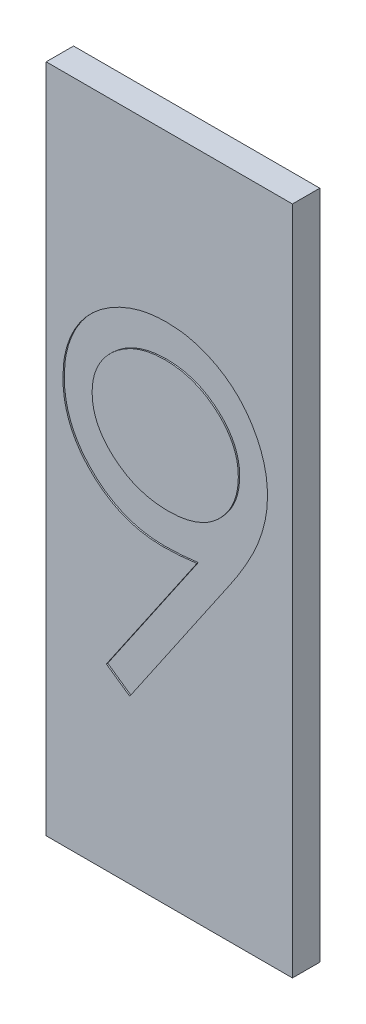
from build123d import *

# Parameters (mm, degrees)
SKETCH_1_W          = 18
SKETCH_1_H          = 49
EXTRUDE_1_DEPTH     = 2
CUT_EXTRUDE_1_DEPTH = 0.1


with BuildPart() as part:
    # ｽｹｯﾁ1 → ﾎﾞｽ - 押し出し1 (new body)
    with BuildSketch(Plane.XY):
        with Locations((9, 24.5)):
            Rectangle(SKETCH_1_W, SKETCH_1_H)
    extrude(amount=EXTRUDE_1_DEPTH)

    # ｽｹｯﾁ2 → ｶｯﾄ - 押し出し1 (cut)
    with BuildSketch(Plane.XY.offset(2)):
        with BuildLine():
            Line((6.105769231, 11.889423077), (4.398061899, 13.077185998))
            Line((4.398061899, 13.077185998), (11.019005409, 22.755784255))
            add(Edge.make_bspline(
                [(11.019005409, 22.755784255), (10.596566654, 22.704124306), (9.764761194, 22.602402987), (8.926989124, 22.583715925), (8.514685998, 22.574519231)],
                knots=[0, 0, 0, 0, 1.015715272, 2, 2, 2, 2], degree=3))
            add(Edge.make_bspline(
                [(8.514685998, 22.574519231), (8.264708851, 22.580921912), (7.774025572, 22.593489814), (7.05263165, 22.693106403), (6.359445961, 22.846527808), (5.696306236, 23.075459517), (5.060719962, 23.359972689), (4.454074662, 23.712785585), (3.877186979, 24.127846247), (3.336252636, 24.602959993), (2.844274555, 25.1246446), (2.405966047, 25.676792814), (2.041695131, 26.265818614), (1.739095506, 26.879706358), (1.509607956, 27.527279477), (1.342494977, 28.201169146), (1.239608959, 28.906098353), (1.227368684, 29.385921118), (1.221153846, 29.629544772)],
                knots=[0, 0, 0, 0, 1.060718605, 2.082097864, 3.085795603, 4.069760067, 5.054557537, 6.03741023, 7.043284206, 8.066802108, 9.088538119, 10.083643548, 11.053783639, 12.022749082, 12.983451788, 13.964007469, 14.966251758, 16, 16, 16, 16], degree=3))
            add(Edge.make_bspline(
                [(1.221153846, 29.629544772), (1.232954197, 29.962706498), (1.256115892, 30.616635383), (1.442523661, 31.572086561), (1.749094898, 32.475509295), (2.176552247, 33.324528293), (2.714950977, 34.10693043), (3.362029063, 34.811839002), (4.113850677, 35.429228097), (4.953289057, 35.95993441), (5.860565859, 36.386756445), (6.810811551, 36.701348828), (7.796745118, 36.886397452), (8.464635874, 36.910794115), (8.80089393, 36.923076923)],
                knots=[0, 0, 0, 0, 1.022988612, 2.007919123, 2.978103895, 3.94594894, 4.918897164, 5.887013414, 6.875921846, 7.89917871, 8.930658928, 9.948724884, 10.967259574, 12, 12, 12, 12], degree=3))
            add(Edge.make_bspline(
                [(8.80089393, 36.923076923), (9.130788356, 36.910625278), (9.782628648, 36.886022001), (10.741177068, 36.705836426), (11.659257915, 36.402147634), (12.531781843, 35.982472298), (13.339633915, 35.45641398), (14.066090774, 34.829570167), (14.694574352, 34.101550419), (15.224054683, 33.289962656), (15.649074065, 32.417969445), (15.955726561, 31.507760972), (16.144495998, 30.565883243), (16.168283509, 29.927745839), (16.180288462, 29.605694111)],
                knots=[0, 0, 0, 0, 1.026385292, 2.028040595, 3.023318987, 4.028184125, 5.03290303, 6.015178782, 7.004435299, 8.016004309, 9.023023918, 10.015172535, 10.998308025, 12, 12, 12, 12], degree=3))
            add(Edge.make_bspline(
                [(16.180288462, 29.605694111), (16.172271072, 29.355705266), (16.156009804, 28.848665427), (16.042143143, 28.078294702), (15.848784383, 27.292814015), (15.629357647, 26.627958159), (15.41754772, 26.078852456), (15.218195378, 25.645114028), (14.996996619, 25.18858579), (14.73901359, 24.714054794), (14.461684392, 24.215471833), (14.148316814, 23.697837642), (13.806059263, 23.160457599), (13.562289206, 22.798187232), (13.43746244, 22.612680288)],
                knots=[0, 0, 0, 0, 1.179839688, 2.393009684, 3.667231171, 4.993948276, 5.694988576, 6.444077775, 7.246288328, 8.089075292, 8.993003841, 9.939041771, 10.944649915, 12, 12, 12, 12], degree=3))
            Line((13.43746244, 22.612680288), (6.105769231, 11.889423077))
        make_face()
        with BuildLine():
            add(Edge.make_bspline(
                [(8.910606971, 25.016826923), (9.099977674, 25.022000248), (9.468618055, 25.032070954), (10.008667179, 25.093365975), (10.518419349, 25.20204613), (10.999236241, 25.357982028), (11.455938913, 25.546146151), (11.881273218, 25.785713413), (12.275595122, 26.07157659), (12.641545126, 26.392773304), (12.96651091, 26.749624595), (13.255955458, 27.123120982), (13.501976461, 27.514901989), (13.696308757, 27.929874005), (13.856087744, 28.357935727), (13.966428147, 28.805980537), (14.0275537, 29.27167412), (14.03797388, 29.588031061), (14.043269231, 29.748798077)],
                knots=[0, 0, 0, 0, 1.163407946, 2.26475976, 3.333800367, 4.359385343, 5.366239384, 6.363380779, 7.350133999, 8.353570782, 9.349036268, 10.310270964, 11.253520213, 12.184142, 13.120487599, 14.056272588, 15.012232024, 16, 16, 16, 16], degree=3))
            add(Edge.make_bspline(
                [(14.043269231, 29.748798077), (14.038713089, 29.909632228), (14.029734652, 30.22657565), (13.957703202, 30.692958702), (13.830985166, 31.139907494), (13.660960619, 31.569868919), (13.436985429, 31.979310378), (13.168220642, 32.373372363), (12.848912368, 32.749556304), (12.481502051, 33.099014835), (12.08529911, 33.421149649), (11.663066064, 33.705444202), (11.218283153, 33.943713413), (10.753663928, 34.140329618), (10.26824034, 34.293762235), (9.762299634, 34.404098234), (9.233285179, 34.465138207), (8.874183928, 34.475492525), (8.691180889, 34.480769231)],
                knots=[0, 0, 0, 0, 0.972161553, 1.915763587, 2.844109794, 3.775983486, 4.705125789, 5.659731448, 6.655561913, 7.682237399, 8.721216875, 9.739758359, 10.754845918, 11.767244016, 12.7857855, 13.828538656, 14.893392813, 16, 16, 16, 16], degree=3))
            add(Edge.make_bspline(
                [(8.691180889, 34.480769231), (8.509769417, 34.475484001), (8.153841603, 34.465114424), (7.62953009, 34.40421426), (7.127010359, 34.293020198), (6.642993264, 34.140400689), (6.178387844, 33.943698746), (5.733625911, 33.705431717), (5.311294101, 33.421215091), (4.915471018, 33.098761371), (4.547411941, 32.751182921), (4.23359361, 32.371724414), (3.964213737, 31.979515364), (3.740546307, 31.569814441), (3.570439895, 31.139922034), (3.443743777, 30.692954764), (3.371706438, 30.226576677), (3.362728809, 29.909632573), (3.358173077, 29.748798077)],
                knots=[0, 0, 0, 0, 1.099389452, 2.15699305, 3.192601482, 4.213358962, 5.227959689, 6.245255729, 7.266013209, 8.307253147, 9.336162325, 10.327954924, 11.284637477, 12.215801273, 13.149702402, 14.080068371, 15.025723358, 16, 16, 16, 16], degree=3))
            add(Edge.make_bspline(
                [(3.358173077, 29.748798077), (3.362295539, 29.587905868), (3.370425787, 29.270596983), (3.448855928, 28.804372775), (3.580017082, 28.357458455), (3.75568115, 27.925508502), (3.987013397, 27.512723181), (4.270884577, 27.121059522), (4.603616953, 26.74607762), (4.980762646, 26.393603554), (5.393522812, 26.070078931), (5.834372103, 25.787524011), (6.295721172, 25.54890613), (6.779194052, 25.357444214), (7.281207816, 25.203604147), (7.806274335, 25.093566276), (8.352657165, 25.03265889), (8.722839363, 25.022154876), (8.910606971, 25.016826923)],
                knots=[0, 0, 0, 0, 0.952633368, 1.87876736, 2.791047057, 3.707742249, 4.635551637, 5.587206343, 6.568248508, 7.601284464, 8.641511608, 9.671105535, 10.699146789, 11.713763218, 12.747829548, 13.806491675, 14.887386225, 16, 16, 16, 16], degree=3))
        make_face(mode=Mode.SUBTRACT)
    extrude(amount=-CUT_EXTRUDE_1_DEPTH, mode=Mode.SUBTRACT)


solid = part.part
